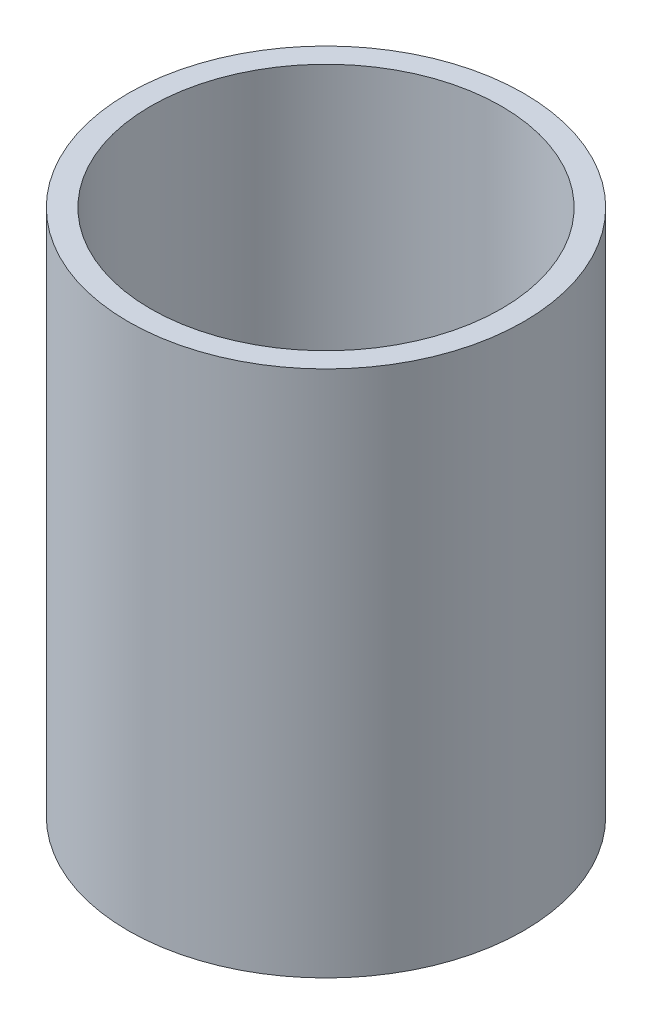
from build123d import *

# Parameters (mm, degrees)
SKETCH1_R           = 57.15
SKETCH1_R_2         = 50.7
BOSS_EXTRUDE1_DEPTH = 76.2


with BuildPart() as part:
    # Sketch1 → Boss-Extrude1 (new, symmetric)
    with BuildSketch(Plane(origin=(0, 0, 0), x_dir=(1, 0, 0), z_dir=(0, 1, 0))):
        with Locations(Location((0, 0, 0), (0, 0, 90))):
            Circle(SKETCH1_R)
        with Locations(Location((0, 0, 0), (0, 0, 90))):
            Circle(SKETCH1_R_2, mode=Mode.SUBTRACT)
    extrude(amount=BOSS_EXTRUDE1_DEPTH, both=True)


solid = part.part
